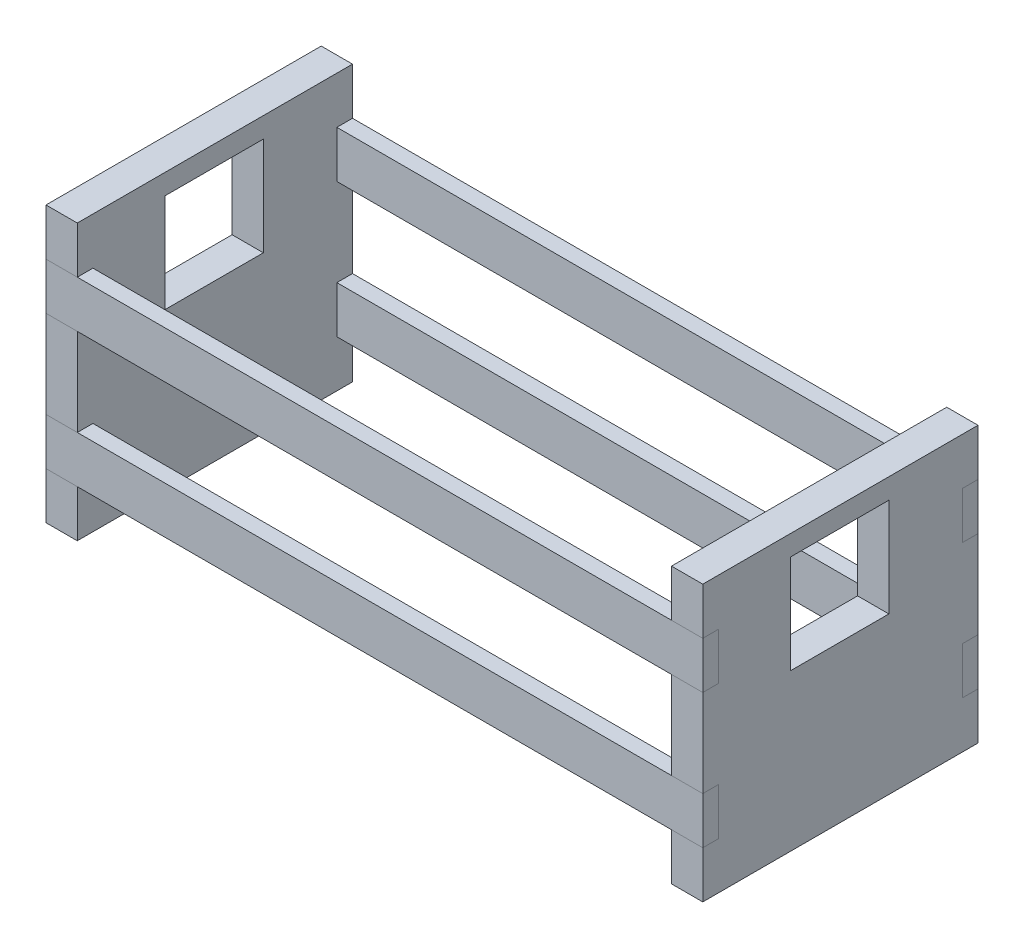
from build123d import *

# Parameters (mm, degrees)
SKETCH1_W             = 22.352
SKETCH1_H             = 22.352
BOSS_EXTRUDE1_DEPTH   = 2.54
LPATTERN1_COUNT       = 2
LPATTERN1_PITCH       = 50.8
SKETCH2_W             = 8.001
SKETCH2_H             = 8.001
SKETCH2_W_2           = 1.27
SKETCH2_H_2           = 3.81
CUT_EXTRUDE1_DEPTH    = 63.003059666
SKETCH3_W             = 1.27
SKETCH3_H             = 3.81
BOSS_EXTRUDE2_DEPTH   = 53.34
BOSS_EXTRUDE2_2_DEPTH = 53.34
BOSS_EXTRUDE2_3_DEPTH = 53.34
BOSS_EXTRUDE2_4_DEPTH = 53.34


with BuildPart() as part:
    # Sketch1 → Boss-Extrude1 (new body)
    with BuildSketch(Plane(origin=(0, 0, 0), x_dir=(0, 0, -1), z_dir=(1, 0, 0))):
        with Locations((11.176, 11.176)):
            Rectangle(SKETCH1_W, SKETCH1_H)
    extrude(amount=BOSS_EXTRUDE1_DEPTH)


with BuildPart() as lpattern1_1:
    # LPattern1: pattern copy
    add(part.part.moved(Location(Vector(-1, 0, 0) * (1 * LPATTERN1_PITCH))))


with BuildPart() as cut_extrude1_tool:
    # Sketch2 → Cut-Extrude1 (new, through all)
    with BuildSketch(Plane(origin=(2.54, 0, 0), x_dir=(0, 0, -1), z_dir=(1, 0, 0))):
        with Locations((11.1125, 16.7005)):
            Rectangle(SKETCH2_W, SKETCH2_H)
        with Locations((0.635, 16.637)):
            Rectangle(SKETCH2_W_2, SKETCH2_H_2)
        with Locations((21.717, 16.637)):
            Rectangle(SKETCH2_W_2, SKETCH2_H_2)
        with Locations((21.717, 5.715)):
            Rectangle(SKETCH2_W_2, SKETCH2_H_2)
        with Locations((0.635, 5.715)):
            Rectangle(SKETCH2_W_2, SKETCH2_H_2)
    extrude(amount=-CUT_EXTRUDE1_DEPTH)


with BuildPart() as part_1:
    add(part.part)

    # Cut-Extrude1: cut by cut_extrude1_tool
    add(cut_extrude1_tool.part, mode=Mode.SUBTRACT)


with BuildPart() as lpattern1_1_1:
    add(lpattern1_1.part)

    # Cut-Extrude1: cut by cut_extrude1_tool
    add(cut_extrude1_tool.part, mode=Mode.SUBTRACT)


with BuildPart() as body_3:
    # Sketch3 → Boss-Extrude2 (new body)
    with BuildSketch(Plane(origin=(2.54, 0, 0), x_dir=(0, 0, -1), z_dir=(1, 0, 0))):
        with Locations((0.635, 16.637)):
            Rectangle(SKETCH3_W, SKETCH3_H)
    extrude(amount=-BOSS_EXTRUDE2_DEPTH)


with BuildPart() as body_4:
    # Sketch3 → Boss-Extrude2 2 (new body)
    with BuildSketch(Plane(origin=(2.54, 0, 0), x_dir=(0, 0, -1), z_dir=(1, 0, 0))):
        with Locations((0.635, 5.715)):
            Rectangle(SKETCH3_W, SKETCH3_H)
    extrude(amount=-BOSS_EXTRUDE2_2_DEPTH)


with BuildPart() as body_5:
    # Sketch3 → Boss-Extrude2 3 (new body)
    with BuildSketch(Plane(origin=(2.54, 0, 0), x_dir=(0, 0, -1), z_dir=(1, 0, 0))):
        with Locations((21.717, 16.637)):
            Rectangle(SKETCH3_W, SKETCH3_H)
    extrude(amount=-BOSS_EXTRUDE2_3_DEPTH)


with BuildPart() as body_6:
    # Sketch3 → Boss-Extrude2 4 (new body)
    with BuildSketch(Plane(origin=(2.54, 0, 0), x_dir=(0, 0, -1), z_dir=(1, 0, 0))):
        with Locations((21.717, 5.715)):
            Rectangle(SKETCH3_W, SKETCH3_H)
    extrude(amount=-BOSS_EXTRUDE2_4_DEPTH)


solid = Compound([part_1.part, lpattern1_1_1.part, body_3.part, body_4.part, body_5.part, body_6.part])
